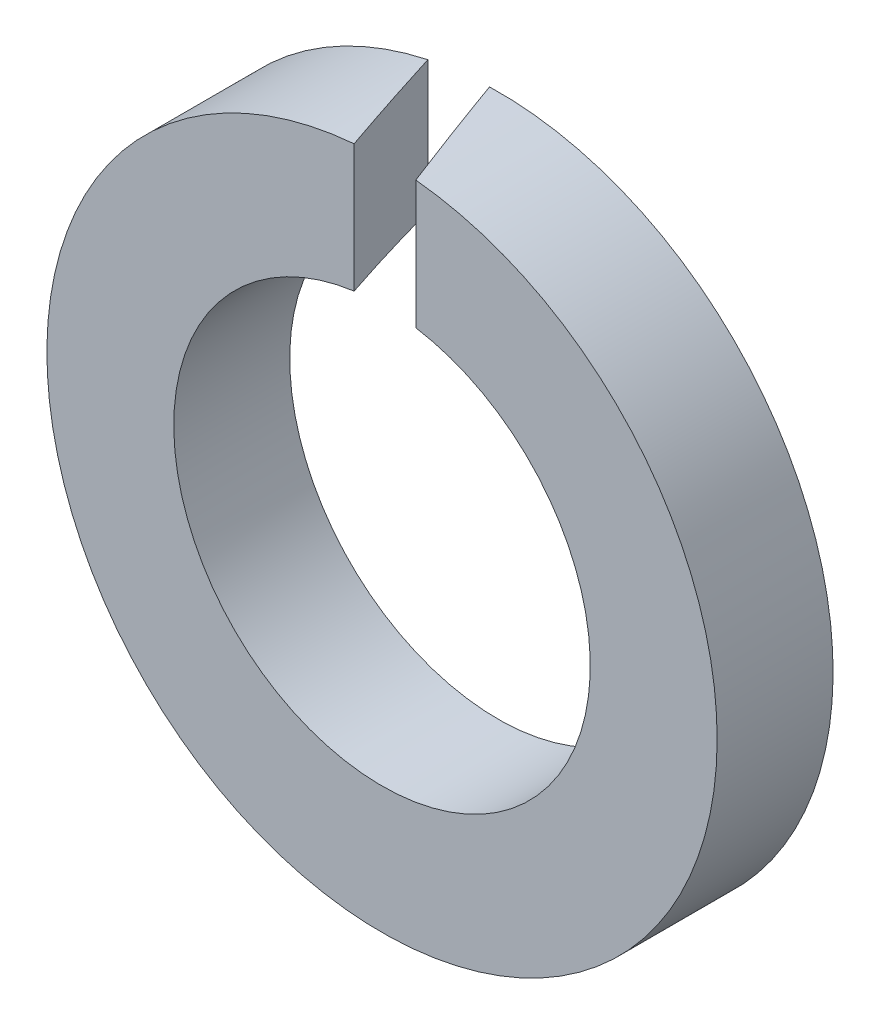
from build123d import *

# Parameters (mm, degrees)
SKETCH1_R          = 15.32
SKETCH1_R_2        = 9.52
BASE_EXTRUDE_DEPTH = 5.3
CUT_EXTRUDE1_DEPTH = 25.080039606


with BuildPart() as part:
    # Sketch1 → Base-Extrude (new body)
    with BuildSketch(Plane.XY):
        Circle(SKETCH1_R)
        Circle(SKETCH1_R_2, mode=Mode.SUBTRACT)
    extrude(amount=-BASE_EXTRUDE_DEPTH)

    # Sketch2 → Cut-Extrude1 (cut, through all)
    with BuildSketch(Plane(origin=(-3.021630199, 0, -2.345256512), x_dir=(0, 0, -1), z_dir=(0, 1, 0))):
        Polygon((-2.345256512, -1.744616872), (2.954743488, 0.18442537), (2.954743488, -2.635645727), (-2.345256512, -4.564687969), align=None)
    extrude(amount=CUT_EXTRUDE1_DEPTH, mode=Mode.SUBTRACT)


solid = part.part
